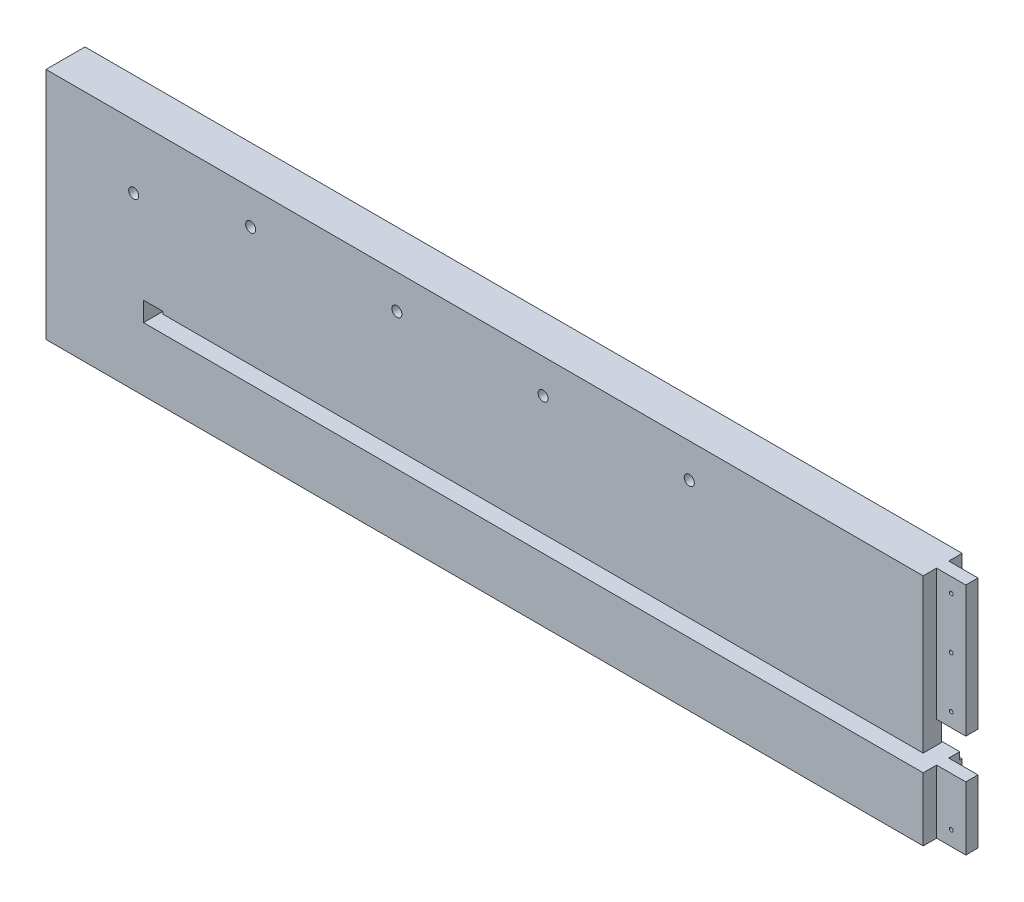
from build123d import *

# Parameters (mm, degrees)
SKETCH1_W               = 2362.2
SKETCH1_H               = 609.6
SKETCH1_R               = 13.119830451
SKETCH1_W_2             = 50.8
SKETCH1_H_2             = 50.8
BOSS_EXTRUDE1_DEPTH     = 101.6
SKETCH2_W               = 127
SKETCH2_H               = 63.5
CUT_EXTRUDE1_DEPTH      = 50.8
SKETCH3_R               = 4.7625
CUT_EXTRUDE2_DEPTH      = 152.4
SKETCH4_W               = 76.2
SKETCH4_H               = 34.925
CUT_EXTRUDE3_DEPTH      = 1334.016102678
CUT_EXTRUDE4_DEPTH      = 2384.94933671
CUT_EXTRUDE4_DEPTH_BACK = 352.425
SKETCH5_W               = 6.35
SKETCH5_H               = 19.05
SKETCH6_W               = 101.6
SKETCH6_H               = 103.1875
CUT_EXTRUDE5_DEPTH      = 76.2
SKETCH7_R               = 4.7625
CUT_EXTRUDE6_DEPTH      = 1222.6160631
SKETCH9_W               = 1704.975
SKETCH9_H               = 44.45
CUT_EXTRUDE7_DEPTH      = 1225.019121583


with BuildPart() as part:
    # Sketch1 → Boss-Extrude1 (new body)
    with BuildSketch(Plane.XY):
        Rectangle(SKETCH1_W, SKETCH1_H)
        with Locations((-952.5, 139.7)):
            Circle(SKETCH1_R, mode=Mode.SUBTRACT)
        with Locations((-647.7, 215.9)):
            Circle(SKETCH1_R, mode=Mode.SUBTRACT)
        with Locations((-266.7, 215.9)):
            Circle(SKETCH1_R, mode=Mode.SUBTRACT)
        with Locations((114.3, 215.9)):
            Circle(SKETCH1_R, mode=Mode.SUBTRACT)
        with Locations((495.3, 215.9)):
            Circle(SKETCH1_R, mode=Mode.SUBTRACT)
        with Locations((-901.7, -114.3)):
            Rectangle(SKETCH1_W_2, SKETCH1_H_2, mode=Mode.SUBTRACT)
    extrude(amount=BOSS_EXTRUDE1_DEPTH)

    # Sketch2 → Cut-Extrude1 (cut)
    with BuildSketch(Plane(origin=(0, 0, 0), x_dir=(-1, 0, 0), z_dir=(0, 0, -1))):
        with Locations((736.6, 241.3)):
            Rectangle(SKETCH2_W, SKETCH2_H)
        with Locations((736.6, -241.3)):
            Rectangle(SKETCH2_W, SKETCH2_H)
        with Locations((-812.8, 241.3)):
            Rectangle(SKETCH2_W, SKETCH2_H)
        with Locations((-812.8, -241.3)):
            Rectangle(SKETCH2_W, SKETCH2_H)
    extrude(amount=-CUT_EXTRUDE1_DEPTH, mode=Mode.SUBTRACT)

    # Sketch3 → Cut-Extrude2 (cut)
    with BuildSketch(Plane.XZ.offset(304.8)):
        with Locations((844.55, 25.4)):
            Circle(SKETCH3_R)
        with Locations((781.05, 25.4)):
            Circle(SKETCH3_R)
        with Locations((-704.85, 25.4)):
            Circle(SKETCH3_R)
        with Locations((-768.35, 25.4)):
            Circle(SKETCH3_R)
    extrude(amount=-CUT_EXTRUDE2_DEPTH, mode=Mode.SUBTRACT)

    # Sketch4 → Cut-Extrude3 (cut, through all)
    with BuildSketch(Plane.XZ.offset(304.8)):
        with Locations((1143, 17.4625)):
            Rectangle(SKETCH4_W, SKETCH4_H)
        with Locations((1143, 84.1375)):
            Rectangle(SKETCH4_W, SKETCH4_H)
    extrude(amount=-CUT_EXTRUDE3_DEPTH, mode=Mode.SUBTRACT)

    # Sketch5 → Cut-Extrude4 (cut, two sides: drawn at the far end of the back side and taken through both)
    # profile 1 of 4: a face of its own
    with BuildSketch(Plane(origin=(1181.1, 0, 0), x_dir=(0, 0, -1), z_dir=(1, 0, 0)).offset(-CUT_EXTRUDE4_DEPTH_BACK)):
        with Locations((-3.175, -149.225)):
            Rectangle(SKETCH5_W, SKETCH5_H)
    # profile 2 of 4: a face of its own
    with BuildSketch(Plane(origin=(1181.1, 0, 0), x_dir=(0, 0, -1), z_dir=(1, 0, 0)).offset(-CUT_EXTRUDE4_DEPTH_BACK)):
        Polygon((-6.35, -139.7), (0, -139.7), (0, -36.5125), (-6.35, -36.5125), (-53.975, -36.5125), (-53.975, -77.7875), (-53.975, -95.25), (-101.6, -95.25), (-101.6, -139.7), align=None)
        with BuildLine():
            ThreePointArc((-12.7, -77.7875), (-31.75, -96.8375), (-50.8, -77.7875))
            ThreePointArc((-50.8, -77.7875), (-31.75, -58.7375), (-12.7, -77.7875))
        make_face(mode=Mode.SUBTRACT)
    # profile 3 of 4: a face of its own
    with BuildSketch(Plane(origin=(1181.1, 0, 0), x_dir=(0, 0, -1), z_dir=(1, 0, 0)).offset(-CUT_EXTRUDE4_DEPTH_BACK)):
        with BuildLine():
            ThreePointArc((-12.7, -77.7875), (-31.75, -58.7375), (-50.8, -77.7875))
            ThreePointArc((-50.8, -77.7875), (-31.75, -96.8375), (-12.7, -77.7875))
        make_face()
    # profile 4 of 4: a face of its own
    with BuildSketch(Plane(origin=(1181.1, 0, 0), x_dir=(0, 0, -1), z_dir=(1, 0, 0)).offset(-CUT_EXTRUDE4_DEPTH_BACK)):
        with Locations((-3.175, -26.9875)):
            Rectangle(SKETCH5_W, SKETCH5_H)
    extrude(amount=CUT_EXTRUDE4_DEPTH + CUT_EXTRUDE4_DEPTH_BACK, mode=Mode.SUBTRACT)

    # Sketch6 → Cut-Extrude5 (cut)
    with BuildSketch(Plane(origin=(1181.1, 0, 0), x_dir=(0, 0, -1), z_dir=(1, 0, 0))):
        with Locations((-50.8, -88.10625)):
            Rectangle(SKETCH6_W, SKETCH6_H)
    extrude(amount=-CUT_EXTRUDE5_DEPTH, mode=Mode.SUBTRACT)

    # Sketch7 → Cut-Extrude6 (cut, through all)
    with BuildSketch(Plane.XY.offset(66.675)):
        with Locations((1143, 266.7)):
            Circle(SKETCH7_R)
        with Locations((1143, 133.35)):
            Circle(SKETCH7_R)
        with Locations((1143, 0)):
            Circle(SKETCH7_R)
        with Locations((1143, -266.7)):
            Circle(SKETCH7_R)
    extrude(amount=-CUT_EXTRUDE6_DEPTH, mode=Mode.SUBTRACT)

    # Sketch9 → Cut-Extrude7 (cut, through all)
    with BuildSketch(Plane.XY.offset(101.6)):
        with Locations((-23.8125, -117.475)):
            Rectangle(SKETCH9_W, SKETCH9_H)
    extrude(amount=-CUT_EXTRUDE7_DEPTH, mode=Mode.SUBTRACT)


solid = part.part
